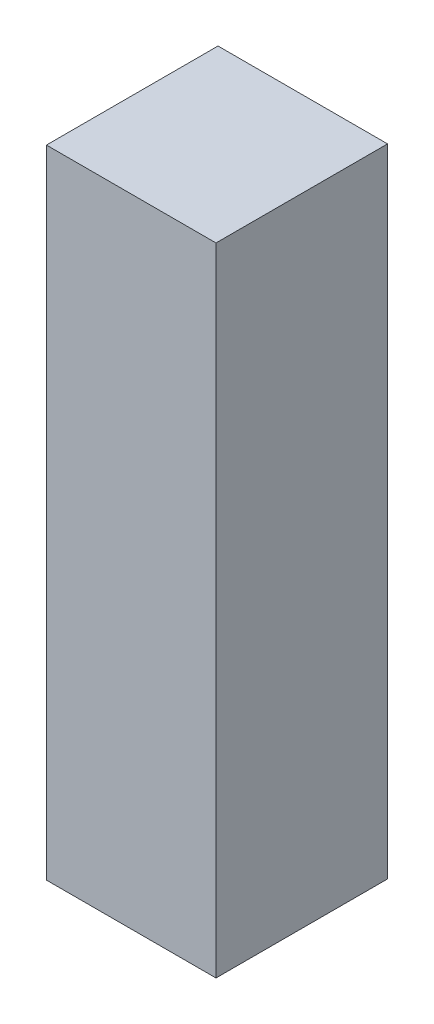
from build123d import *

# Parameters (mm, degrees)
SKETCH1_W           = 10.280356295
SKETCH1_H           = 38.145532569
BOSS_EXTRUDE1_DEPTH = 10.16


with BuildPart() as part:
    # Sketch1 → Boss-Extrude1 (new body)
    with BuildSketch(Plane(origin=(0, 0, 0), x_dir=(0, 0, -1), z_dir=(1, 0, 0))):
        with Locations((-13.800405347, 24.483480124)):
            Rectangle(SKETCH1_W, SKETCH1_H)
    extrude(amount=BOSS_EXTRUDE1_DEPTH)


solid = part.part
